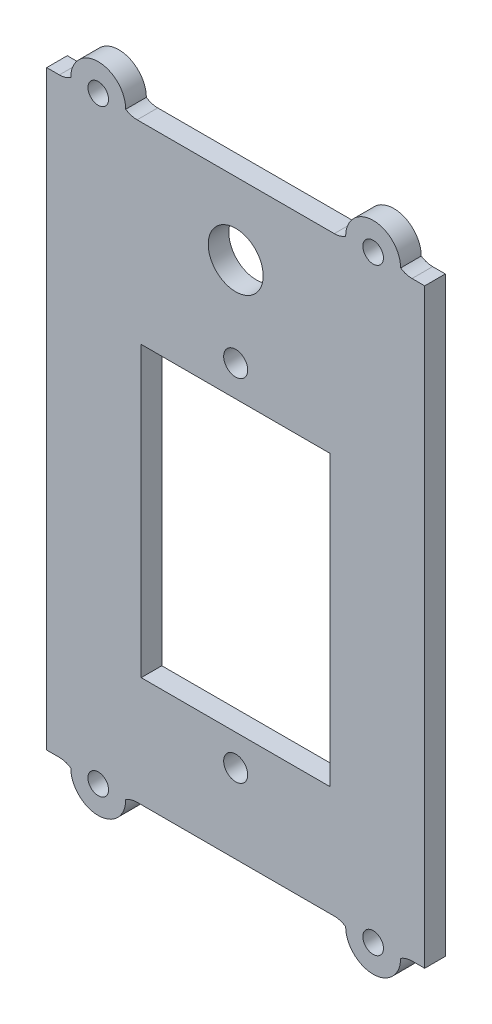
from build123d import *

# Parameters (mm, degrees)
SKETCH1_R           = 1.5
BOSS_EXTRUDE1_DEPTH = 3
SKETCH2_R           = 4
SKETCH2_R_2         = 1.75
SKETCH2_W           = 27.5
SKETCH2_H           = 42
CUT_EXTRUDE1_DEPTH  = 55.968172609


with BuildPart() as part:
    # Sketch1 → Boss-Extrude1 (new body)
    with BuildSketch(Plane.XY):
        with BuildLine():
            ThreePointArc((-14.341687605, -43), (-15.207713009, -43.127718677), (-16, -43.5))
            ThreePointArc((-16, -43.5), (-20, -47.5), (-24, -43.5))
            ThreePointArc((-24, -43.5), (-24.792286991, -43.127718677), (-25.658312395, -43))
            Line((-25.658312395, -43), (-27.5, -43))
            Line((-27.5, -43), (-27.5, 43))
            Line((-27.5, 43), (-25.658312395, 43))
            ThreePointArc((-25.658312395, 43), (-24.792286991, 43.127718677), (-24, 43.5))
            ThreePointArc((-24, 43.5), (-20, 47.5), (-16, 43.5))
            ThreePointArc((-16, 43.5), (-15.207713009, 43.127718677), (-14.341687605, 43))
            Line((-14.341687605, 43), (-10.658312395, 43))
            Line((-10.658312395, 43), (10.658312395, 43))
            Line((10.658312395, 43), (14.341687605, 43))
            ThreePointArc((14.341687605, 43), (15.207713009, 43.127718677), (16, 43.5))
            ThreePointArc((16, 43.5), (20, 47.5), (24, 43.5))
            ThreePointArc((24, 43.5), (24.792286991, 43.127718677), (25.658312395, 43))
            Line((25.658312395, 43), (27.5, 43))
            Line((27.5, 43), (27.5, -43))
            Line((27.5, -43), (25.658312395, -43))
            ThreePointArc((25.658312395, -43), (24.792286991, -43.127718677), (24, -43.5))
            ThreePointArc((24, -43.5), (20, -47.5), (16, -43.5))
            ThreePointArc((16, -43.5), (15.207713009, -43.127718677), (14.341687605, -43))
            Line((14.341687605, -43), (10.658312395, -43))
            Line((10.658312395, -43), (-10.658312395, -43))
            Line((-10.658312395, -43), (-14.341687605, -43))
        make_face()
        with Locations((20, -43.5)):
            Circle(SKETCH1_R, mode=Mode.SUBTRACT)
        with Locations((-20, -43.5)):
            Circle(SKETCH1_R, mode=Mode.SUBTRACT)
        with Locations((20, 43.5)):
            Circle(SKETCH1_R, mode=Mode.SUBTRACT)
        with Locations((-20, 43.5)):
            Circle(SKETCH1_R, mode=Mode.SUBTRACT)
    extrude(amount=BOSS_EXTRUDE1_DEPTH)

    # Sketch2 → Cut-Extrude1 (cut, through all)
    with BuildSketch(Plane.XY):
        with Locations((0, 32.5)):
            Circle(SKETCH2_R)
        with Locations((0, 19.5)):
            Circle(SKETCH2_R_2)
        with Locations((0, -31.5)):
            Circle(SKETCH2_R_2)
        with Locations((0, -6)):
            Rectangle(SKETCH2_W, SKETCH2_H)
    extrude(amount=CUT_EXTRUDE1_DEPTH, mode=Mode.SUBTRACT)


solid = part.part
